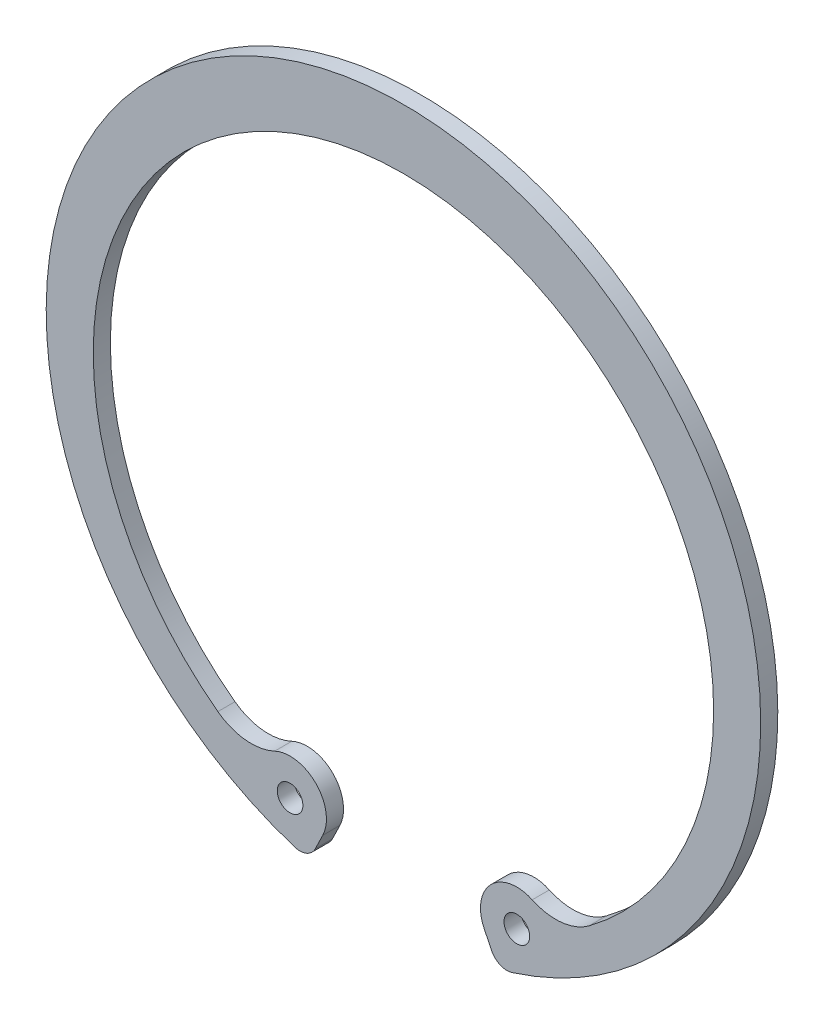
from build123d import *

# Parameters (mm, degrees)
SKETCH_1_R          = 1.5
EXTRUDE_8_165_DEPTH = 2


with BuildPart() as part:
    # Эскиз1 → Бобышка8-165 (new body)
    with BuildSketch(Plane.XY):
        with BuildLine():
            Line((-10.301660458, -38.737628793), (-9.427477508, -36.938794679))
            ThreePointArc((-9.427477508, -36.938794679), (-10.221334445, -32.099598439), (-15.047492413, -31.229984527))
            ThreePointArc((-15.047492413, -31.229984527), (-18.460300533, -31.805984271), (-21.684930892, -30.54868796))
            ThreePointArc((-21.684930892, -30.54868796), (0, 34.75), (21.684930892, -30.54868796))
            ThreePointArc((21.684930892, -30.54868796), (18.460300533, -31.805984271), (15.047492413, -31.229984527))
            ThreePointArc((15.047492413, -31.229984527), (10.221334445, -32.099598439), (9.427477508, -36.938794679))
            Line((9.427477508, -36.938794679), (10.301660458, -38.737628793))
            ThreePointArc((10.301660458, -38.737628793), (11.313275299, -39.702001205), (12.709324487, -39.768524879))
            ThreePointArc((12.709324487, -39.768524879), (0, 41.75), (-12.709324487, -39.768524879))
            ThreePointArc((-12.709324487, -39.768524879), (-11.313275299, -39.702001205), (-10.301660458, -38.737628793))
        make_face()
        with Locations((-13.25, -35.08115591)):
            Circle(SKETCH_1_R, mode=Mode.SUBTRACT)
        with Locations(Location((13.25, -35.08115591, 0), (0, 0, 180))):
            Circle(SKETCH_1_R, mode=Mode.SUBTRACT)
    extrude(amount=EXTRUDE_8_165_DEPTH)


solid = part.part
